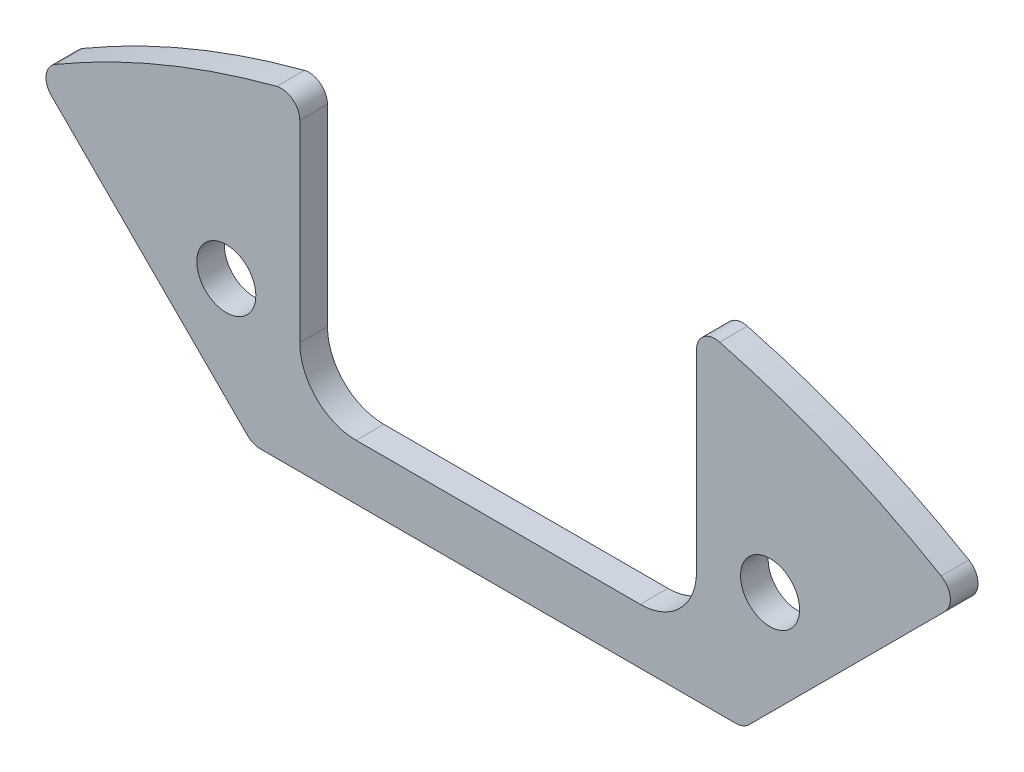
from build123d import *

# Parameters (mm, degrees)
SKETCH_1_R                       = 47.5
EXTRUDE_1_DEPTH                  = 1.5
CUT_EXTRUDE_1_DEPTH              = 68.191889392
CUT_EXTRUDE_2_DEPTH              = 68.191889392
CUT_EXTRUDE_2_DEPTH_BACK         = 68.191889392
SKETCH_3_R                       = 3.1
SKETCH_3_R_2                     = 1.6
SKETCH_4_R                       = 1.6
CUT_EXTRUDE_3_DEPTH              = 68.191889392
CUT_EXTRUDE_4_DEPTH              = 68.191889392
FILLET_1_R                       = 1
FILLET_2_R                       = 0.2
FILLET_3_R                       = 3.05
PATTERN_CIRCULAR_1_COUNT         = 8
FILLET_1_OF_PATTERN_CIRCULAR_1_R = 1
FILLET_2_OF_PATTERN_CIRCULAR_1_R = 0.2
FILLET_3_OF_PATTERN_CIRCULAR_1_R = 3.05
CUT_EXTRUDE_5_DEPTH              = 66.05834985
EXTRUDE_START                    = -1.5
EXTRUDE_2_DEPTH                  = 1.5
FILLET_4_R                       = 1


with BuildPart() as part:
    # ｽｹｯﾁ1 → ﾎﾞｽ - 押し出し1 (new body)
    with BuildSketch(Plane.XY):
        Circle(SKETCH_1_R)
    extrude(amount=EXTRUDE_1_DEPTH)

    # ｽｹｯﾁ2 → ｶｯﾄ - 押し出し1 (cut, through all)
    with BuildSketch(Plane.XY.offset(1.5)):
        Polygon((-10.75, 43.525), (-10.75, 52.5), (10.75, 52.5), (10.75, 43.525), (13, 43.525), (13, 40.475), (10.75, 40.475), (10.75, 31.5), (-10.75, 31.5), (-10.75, 40.475), (-13, 40.475), (-13, 43.525), align=None)
    cut_extrude_1 = extrude(amount=-CUT_EXTRUDE_1_DEPTH, mode=Mode.SUBTRACT)

    # ｽｹｯﾁ3 → ｶｯﾄ - 押し出し2 (cut, two sides: drawn at the far end of the back side and taken through both)
    with BuildSketch(Plane.XY.offset(1.5).offset(-CUT_EXTRUDE_2_DEPTH_BACK)):
        Circle(SKETCH_3_R)
        with Locations((0, 6.5)):
            Circle(SKETCH_3_R_2)
        with Locations((6.5, 0)):
            Circle(SKETCH_3_R_2)
        with Locations((0, -6.5)):
            Circle(SKETCH_3_R_2)
        with Locations((-6.5, 0)):
            Circle(SKETCH_3_R_2)
        with Locations((8.838834765, 8.838834765)):
            Circle(SKETCH_3_R_2)
        with Locations((8.838834765, -8.838834765)):
            Circle(SKETCH_3_R_2)
        with Locations((-8.838834765, -8.838834765)):
            Circle(SKETCH_3_R_2)
        with Locations((-8.838834765, 8.838834765)):
            Circle(SKETCH_3_R_2)
    extrude(amount=CUT_EXTRUDE_2_DEPTH + CUT_EXTRUDE_2_DEPTH_BACK, mode=Mode.SUBTRACT)

    # ｽｹｯﾁ4 → ｶｯﾄ - 押し出し3 (cut, through all)
    with BuildSketch(Plane.XY.offset(1.5)):
        with Locations((14.733312146, 35.569362002)):
            Circle(SKETCH_4_R)
        with Locations((8.610377228, 20.787289482)):
            Circle(SKETCH_4_R)
    cut_extrude_3 = extrude(amount=-CUT_EXTRUDE_3_DEPTH, mode=Mode.SUBTRACT)

    # ｽｹｯﾁ5 → ｶｯﾄ - 押し出し4 (cut, symmetric)
    with BuildSketch(Plane.XY.offset(1.5)):
        Polygon((-7.188286702, 26.5), (7.188286702, 26.5), (3.328075632, 17.180626082), (-3.328075632, 17.180626082), align=None)
    cut_extrude_4 = extrude(amount=CUT_EXTRUDE_4_DEPTH, both=True, mode=Mode.SUBTRACT)

    # ﾌｨﾚｯﾄ1
    fillet_1_edges = [part.edges().sort_by_distance(p)[0] for p in [
        (-3.328075632, 17.180626082, 0.75),
        (3.328075632, 17.180626082, 0.75),
        (7.188286702, 26.5, 0.75),
        (-7.188286702, 26.5, 0.75),
        (10.75, 46.267564232, 0.75),
        (-10.75, 46.267564232, 0.75),
    ]]
    fillet(fillet_1_edges, radius=FILLET_1_R)

    # ﾌｨﾚｯﾄ2
    fillet_2_edges = [part.edges().sort_by_distance(p)[0] for p in [
        (13, 43.525, 0.75),
        (13, 40.475, 0.75),
        (-13, 43.525, 0.75),
        (-13, 40.475, 0.75),
    ]]
    fillet(fillet_2_edges, radius=FILLET_2_R)

    # ﾌｨﾚｯﾄ3
    fillet_3_edges = [part.edges().sort_by_distance(p)[0] for p in [
        (10.75, 31.5, 0.75),
        (-10.75, 31.5, 0.75),
    ]]
    fillet(fillet_3_edges, radius=FILLET_3_R)

    # 円形ﾊﾟﾀｰﾝ1: ｶｯﾄ - 押し出し1, ｶｯﾄ - 押し出し3, ｶｯﾄ - 押し出し4 ×8 about axis
    pattern_circular_1_axis = Axis((0, 0, 0), (0, 0, 1))
    add([cut_extrude_1.rotate(pattern_circular_1_axis, i * 360 / PATTERN_CIRCULAR_1_COUNT) for i in range(1, PATTERN_CIRCULAR_1_COUNT)], mode=Mode.SUBTRACT)
    add([cut_extrude_3.rotate(pattern_circular_1_axis, i * 360 / PATTERN_CIRCULAR_1_COUNT) for i in range(1, PATTERN_CIRCULAR_1_COUNT)], mode=Mode.SUBTRACT)
    add([cut_extrude_4.rotate(pattern_circular_1_axis, i * 360 / PATTERN_CIRCULAR_1_COUNT) for i in range(1, PATTERN_CIRCULAR_1_COUNT)], mode=Mode.SUBTRACT)

    # ﾌｨﾚｯﾄ1 of 円形ﾊﾟﾀｰﾝ1
    fillet_1_of_pattern_circular_1_edges = [part.edges().sort_by_distance(p)[0] for p in [
        (-14.501842056, 9.79523236, 0.75),
        (-9.79523236, 14.501842056, 0.75),
        (-13.655443429, 23.821215973, 0.75),
        (-23.821215973, 13.655443429, 0.75),
        (-25.11471052, 40.317506315, 0.75),
        (-40.317506315, 25.11471052, 0.75),
        (-17.180626082, -3.328075632, 0.75),
        (-17.180626082, 3.328075632, 0.75),
        (-26.5, 7.188286702, 0.75),
        (-26.5, -7.188286702, 0.75),
        (-46.267564232, 10.75, 0.75),
        (-46.267564232, -10.75, 0.75),
        (-9.79523236, -14.501842056, 0.75),
        (-14.501842056, -9.79523236, 0.75),
        (-23.821215973, -13.655443429, 0.75),
        (-13.655443429, -23.821215973, 0.75),
        (-40.317506315, -25.11471052, 0.75),
        (-25.11471052, -40.317506315, 0.75),
        (3.328075632, -17.180626082, 0.75),
        (-3.328075632, -17.180626082, 0.75),
        (-7.188286702, -26.5, 0.75),
        (7.188286702, -26.5, 0.75),
        (-10.75, -46.267564232, 0.75),
        (10.75, -46.267564232, 0.75),
        (14.501842056, -9.79523236, 0.75),
        (9.79523236, -14.501842056, 0.75),
        (13.655443429, -23.821215973, 0.75),
        (23.821215973, -13.655443429, 0.75),
        (25.11471052, -40.317506315, 0.75),
        (40.317506315, -25.11471052, 0.75),
        (17.180626082, 3.328075632, 0.75),
        (17.180626082, -3.328075632, 0.75),
        (26.5, -7.188286702, 0.75),
        (26.5, 7.188286702, 0.75),
        (46.267564232, -10.75, 0.75),
        (46.267564232, 10.75, 0.75),
        (9.79523236, 14.501842056, 0.75),
        (14.501842056, 9.79523236, 0.75),
        (23.821215973, 13.655443429, 0.75),
        (13.655443429, 23.821215973, 0.75),
        (40.317506315, 25.11471052, 0.75),
        (25.11471052, 40.317506315, 0.75),
    ]]
    fillet(fillet_1_of_pattern_circular_1_edges, radius=FILLET_1_OF_PATTERN_CIRCULAR_1_R)

    # ﾌｨﾚｯﾄ2 of 円形ﾊﾟﾀｰﾝ1
    fillet_2_of_pattern_circular_1_edges = [part.edges().sort_by_distance(p)[0] for p in [
        (-21.584434496, 39.969210807, 0.75),
        (-19.427758813, 37.812535124, 0.75),
        (-39.969210807, 21.584434496, 0.75),
        (-37.812535124, 19.427758813, 0.75),
        (-43.525, 13, 0.75),
        (-40.475, 13, 0.75),
        (-43.525, -13, 0.75),
        (-40.475, -13, 0.75),
        (-39.969210807, -21.584434496, 0.75),
        (-37.812535124, -19.427758813, 0.75),
        (-21.584434496, -39.969210807, 0.75),
        (-19.427758813, -37.812535124, 0.75),
        (-13, -43.525, 0.75),
        (-13, -40.475, 0.75),
        (13, -43.525, 0.75),
        (13, -40.475, 0.75),
        (21.584434496, -39.969210807, 0.75),
        (19.427758813, -37.812535124, 0.75),
        (39.969210807, -21.584434496, 0.75),
        (37.812535124, -19.427758813, 0.75),
        (43.525, -13, 0.75),
        (40.475, -13, 0.75),
        (43.525, 13, 0.75),
        (40.475, 13, 0.75),
        (39.969210807, 21.584434496, 0.75),
        (37.812535124, 19.427758813, 0.75),
        (21.584434496, 39.969210807, 0.75),
        (19.427758813, 37.812535124, 0.75),
    ]]
    fillet(fillet_2_of_pattern_circular_1_edges, radius=FILLET_2_OF_PATTERN_CIRCULAR_1_R)

    # ﾌｨﾚｯﾄ3 of 円形ﾊﾟﾀｰﾝ1
    fillet_3_of_pattern_circular_1_edges = [part.edges().sort_by_distance(p)[0] for p in [
        (-14.67246571, 29.875261505, 0.75),
        (-29.875261505, 14.67246571, 0.75),
        (-31.5, 10.75, 0.75),
        (-31.5, -10.75, 0.75),
        (-29.875261505, -14.67246571, 0.75),
        (-14.67246571, -29.875261505, 0.75),
        (-10.75, -31.5, 0.75),
        (10.75, -31.5, 0.75),
        (14.67246571, -29.875261505, 0.75),
        (29.875261505, -14.67246571, 0.75),
        (31.5, -10.75, 0.75),
        (31.5, 10.75, 0.75),
        (29.875261505, 14.67246571, 0.75),
        (14.67246571, 29.875261505, 0.75),
    ]]
    fillet(fillet_3_of_pattern_circular_1_edges, radius=FILLET_3_OF_PATTERN_CIRCULAR_1_R)

    # ｽｹｯﾁ6 → ｶｯﾄ - 押し出し5 (cut, through all)
    with BuildSketch(Plane.XY.offset(1.5)):
        with BuildLine():
            Line((13.297204204, 28.5), (7.7, 28.5))
            Line((7.7, 28.5), (-7.7, 28.5))
            Line((-7.7, 28.5), (-13.297204204, 28.5))
            Line((-13.297204204, 28.5), (-16.829141392, 32.031937188))
            ThreePointArc((-16.829141392, 32.031937188), (-15.935817075, 29.875261505), (-16.829141392, 27.718585823))
            Line((-16.829141392, 27.718585823), (-27.718585823, 16.829141392))
            ThreePointArc((-27.718585823, 16.829141392), (-29.875261505, 15.935817075), (-32.031937188, 16.829141392))
            Line((-32.031937188, 16.829141392), (-36.221544866, 21.018749071))
            Line((-36.221544866, 21.018749071), (-37.671113768, 19.569180169))
            ThreePointArc((-37.671113768, 19.569180169), (-37.812535124, 19.510601526), (-37.95395648, 19.569180169))
            Line((-37.95395648, 19.569180169), (-39.82778945, 21.443013139))
            ThreePointArc((-39.82778945, 21.443013139), (-39.886368094, 21.584434496), (-39.82778945, 21.725855852))
            Line((-39.82778945, 21.725855852), (-38.378220549, 23.175424753))
            Line((-38.378220549, 23.175424753), (-39.414818808, 24.212023012))
            ThreePointArc((-39.414818808, 24.212023012), (-40.249307357, 24.496769993), (-40.984762698, 24.010398301))
            ThreePointArc((-40.984762698, 24.010398301), (-43.884277794, 18.177463037), (-45.958519087, 12.002688172))
            ThreePointArc((-45.958519087, 12.002688172), (-45.78239035, 11.138725991), (-44.990971316, 10.75))
            Line((-44.990971316, 10.75), (-43.525, 10.75))
            Line((-43.525, 10.75), (-43.525, 12.8))
            ThreePointArc((-43.525, 12.8), (-43.466421356, 12.941421356), (-43.325, 13))
            Line((-43.325, 13), (-40.675, 13))
            ThreePointArc((-40.675, 13), (-40.533578644, 12.941421356), (-40.475, 12.8))
            Line((-40.475, 12.8), (-40.475, 10.75))
            Line((-40.475, 10.75), (-34.55, 10.75))
            ThreePointArc((-34.55, 10.75), (-32.393324317, 9.856675683), (-31.5, 7.7))
            Line((-31.5, 7.7), (-31.5, -7.7))
            ThreePointArc((-31.5, -7.7), (-32.393324317, -9.856675683), (-34.55, -10.75))
            Line((-34.55, -10.75), (-40.475, -10.75))
            Line((-40.475, -10.75), (-40.475, -12.8))
            ThreePointArc((-40.475, -12.8), (-40.533578644, -12.941421356), (-40.675, -13))
            Line((-40.675, -13), (-43.325, -13))
            ThreePointArc((-43.325, -13), (-43.466421356, -12.941421356), (-43.525, -12.8))
            Line((-43.525, -12.8), (-43.525, -10.75))
            Line((-43.525, -10.75), (-44.990971316, -10.75))
            ThreePointArc((-44.990971316, -10.75), (-45.78239035, -11.138725991), (-45.958519087, -12.002688172))
            ThreePointArc((-45.958519087, -12.002688172), (-43.884277794, -18.177463037), (-40.984762698, -24.010398301))
            ThreePointArc((-40.984762698, -24.010398301), (-40.249307357, -24.496769993), (-39.414818808, -24.212023012))
            Line((-39.414818808, -24.212023012), (-38.378220549, -23.175424753))
            Line((-38.378220549, -23.175424753), (-39.82778945, -21.725855852))
            ThreePointArc((-39.82778945, -21.725855852), (-39.886368094, -21.584434496), (-39.82778945, -21.443013139))
            Line((-39.82778945, -21.443013139), (-37.95395648, -19.569180169))
            ThreePointArc((-37.95395648, -19.569180169), (-37.812535124, -19.510601526), (-37.671113768, -19.569180169))
            Line((-37.671113768, -19.569180169), (-36.221544866, -21.018749071))
            Line((-36.221544866, -21.018749071), (-32.031937188, -16.829141392))
            ThreePointArc((-32.031937188, -16.829141392), (-29.875261505, -15.935817075), (-27.718585823, -16.829141392))
            Line((-27.718585823, -16.829141392), (-16.829141392, -27.718585823))
            ThreePointArc((-16.829141392, -27.718585823), (-15.935817075, -29.875261505), (-16.829141392, -32.031937188))
            Line((-16.829141392, -32.031937188), (-21.018749071, -36.221544866))
            Line((-21.018749071, -36.221544866), (-19.569180169, -37.671113768))
            ThreePointArc((-19.569180169, -37.671113768), (-19.510601526, -37.812535124), (-19.569180169, -37.95395648))
            Line((-19.569180169, -37.95395648), (-21.443013139, -39.82778945))
            ThreePointArc((-21.443013139, -39.82778945), (-21.584434496, -39.886368094), (-21.725855852, -39.82778945))
            Line((-21.725855852, -39.82778945), (-23.175424753, -38.378220549))
            Line((-23.175424753, -38.378220549), (-24.212023012, -39.414818808))
            ThreePointArc((-24.212023012, -39.414818808), (-24.496769993, -40.249307357), (-24.010398301, -40.984762698))
            ThreePointArc((-24.010398301, -40.984762698), (-18.177463037, -43.884277794), (-12.002688172, -45.958519087))
            ThreePointArc((-12.002688172, -45.958519087), (-11.138725991, -45.78239035), (-10.75, -44.990971316))
            Line((-10.75, -44.990971316), (-10.75, -43.525))
            Line((-10.75, -43.525), (-12.8, -43.525))
            ThreePointArc((-12.8, -43.525), (-12.941421356, -43.466421356), (-13, -43.325))
            Line((-13, -43.325), (-13, -40.675))
            ThreePointArc((-13, -40.675), (-12.941421356, -40.533578644), (-12.8, -40.475))
            Line((-12.8, -40.475), (-10.75, -40.475))
            Line((-10.75, -40.475), (-10.75, -34.55))
            ThreePointArc((-10.75, -34.55), (-9.856675683, -32.393324317), (-7.7, -31.5))
            Line((-7.7, -31.5), (7.7, -31.5))
            ThreePointArc((7.7, -31.5), (9.856675683, -32.393324317), (10.75, -34.55))
            Line((10.75, -34.55), (10.75, -40.475))
            Line((10.75, -40.475), (12.8, -40.475))
            ThreePointArc((12.8, -40.475), (12.941421356, -40.533578644), (13, -40.675))
            Line((13, -40.675), (13, -43.325))
            ThreePointArc((13, -43.325), (12.941421356, -43.466421356), (12.8, -43.525))
            Line((12.8, -43.525), (10.75, -43.525))
            Line((10.75, -43.525), (10.75, -44.990971316))
            ThreePointArc((10.75, -44.990971316), (11.138725991, -45.78239035), (12.002688172, -45.958519087))
            ThreePointArc((12.002688172, -45.958519087), (18.177463037, -43.884277794), (24.010398301, -40.984762698))
            ThreePointArc((24.010398301, -40.984762698), (24.496769993, -40.249307357), (24.212023012, -39.414818808))
            Line((24.212023012, -39.414818808), (23.175424753, -38.378220549))
            Line((23.175424753, -38.378220549), (21.725855852, -39.82778945))
            ThreePointArc((21.725855852, -39.82778945), (21.584434496, -39.886368094), (21.443013139, -39.82778945))
            Line((21.443013139, -39.82778945), (19.569180169, -37.95395648))
            ThreePointArc((19.569180169, -37.95395648), (19.510601526, -37.812535124), (19.569180169, -37.671113768))
            Line((19.569180169, -37.671113768), (21.018749071, -36.221544866))
            Line((21.018749071, -36.221544866), (16.829141392, -32.031937188))
            ThreePointArc((16.829141392, -32.031937188), (15.935817075, -29.875261505), (16.829141392, -27.718585823))
            Line((16.829141392, -27.718585823), (27.718585823, -16.829141392))
            ThreePointArc((27.718585823, -16.829141392), (29.875261505, -15.935817075), (32.031937188, -16.829141392))
            Line((32.031937188, -16.829141392), (36.221544866, -21.018749071))
            Line((36.221544866, -21.018749071), (37.671113768, -19.569180169))
            ThreePointArc((37.671113768, -19.569180169), (37.812535124, -19.510601526), (37.95395648, -19.569180169))
            Line((37.95395648, -19.569180169), (39.82778945, -21.443013139))
            ThreePointArc((39.82778945, -21.443013139), (39.886368094, -21.584434496), (39.82778945, -21.725855852))
            Line((39.82778945, -21.725855852), (38.378220549, -23.175424753))
            Line((38.378220549, -23.175424753), (39.414818808, -24.212023012))
            ThreePointArc((39.414818808, -24.212023012), (40.249307357, -24.496769993), (40.984762698, -24.010398301))
            ThreePointArc((40.984762698, -24.010398301), (43.884277794, -18.177463037), (45.958519087, -12.002688172))
            ThreePointArc((45.958519087, -12.002688172), (45.78239035, -11.138725991), (44.990971316, -10.75))
            Line((44.990971316, -10.75), (43.525, -10.75))
            Line((43.525, -10.75), (43.525, -12.8))
            ThreePointArc((43.525, -12.8), (43.466421356, -12.941421356), (43.325, -13))
            Line((43.325, -13), (40.675, -13))
            ThreePointArc((40.675, -13), (40.533578644, -12.941421356), (40.475, -12.8))
            Line((40.475, -12.8), (40.475, -10.75))
            Line((40.475, -10.75), (34.55, -10.75))
            ThreePointArc((34.55, -10.75), (32.393324317, -9.856675683), (31.5, -7.7))
            Line((31.5, -7.7), (31.5, 7.7))
            ThreePointArc((31.5, 7.7), (32.393324317, 9.856675683), (34.55, 10.75))
            Line((34.55, 10.75), (40.475, 10.75))
            Line((40.475, 10.75), (40.475, 12.8))
            ThreePointArc((40.475, 12.8), (40.533578644, 12.941421356), (40.675, 13))
            Line((40.675, 13), (43.325, 13))
            ThreePointArc((43.325, 13), (43.466421356, 12.941421356), (43.525, 12.8))
            Line((43.525, 12.8), (43.525, 10.75))
            Line((43.525, 10.75), (44.990971316, 10.75))
            ThreePointArc((44.990971316, 10.75), (45.78239035, 11.138725991), (45.958519087, 12.002688172))
            ThreePointArc((45.958519087, 12.002688172), (43.884277794, 18.177463037), (40.984762698, 24.010398301))
            ThreePointArc((40.984762698, 24.010398301), (40.249307357, 24.496769993), (39.414818808, 24.212023012))
            Line((39.414818808, 24.212023012), (38.378220549, 23.175424753))
            Line((38.378220549, 23.175424753), (39.82778945, 21.725855852))
            ThreePointArc((39.82778945, 21.725855852), (39.886368094, 21.584434496), (39.82778945, 21.443013139))
            Line((39.82778945, 21.443013139), (37.95395648, 19.569180169))
            ThreePointArc((37.95395648, 19.569180169), (37.812535124, 19.510601526), (37.671113768, 19.569180169))
            Line((37.671113768, 19.569180169), (36.221544866, 21.018749071))
            Line((36.221544866, 21.018749071), (32.031937188, 16.829141392))
            ThreePointArc((32.031937188, 16.829141392), (29.875261505, 15.935817075), (27.718585823, 16.829141392))
            Line((27.718585823, 16.829141392), (16.829141392, 27.718585823))
            ThreePointArc((16.829141392, 27.718585823), (15.935817075, 29.875261505), (16.829141392, 32.031937188))
            Line((16.829141392, 32.031937188), (13.297204204, 28.5))
        make_face()
    extrude(amount=-CUT_EXTRUDE_5_DEPTH, mode=Mode.SUBTRACT)

    # ｽｹｯﾁ7 → ﾎﾞｽ - 押し出し2 (add)
    with BuildSketch(Plane.XY.offset(1.5).offset(EXTRUDE_START)):
        with BuildLine():
            Line((-10.75, 40.475), (-10.75, 43.525))
            Line((-10.75, 43.525), (-12.8, 43.525))
            ThreePointArc((-12.8, 43.525), (-12.941421356, 43.466421356), (-13, 43.325))
            Line((-13, 43.325), (-13, 40.675))
            ThreePointArc((-13, 40.675), (-12.941421356, 40.533578644), (-12.8, 40.475))
            Line((-12.8, 40.475), (-10.75, 40.475))
        make_face()
        with BuildLine():
            Line((-21.725855852, 39.82778945), (-23.175424753, 38.378220549))
            Line((-23.175424753, 38.378220549), (-21.018749071, 36.221544866))
            Line((-21.018749071, 36.221544866), (-19.569180169, 37.671113768))
            ThreePointArc((-19.569180169, 37.671113768), (-19.510601526, 37.812535124), (-19.569180169, 37.95395648))
            Line((-19.569180169, 37.95395648), (-21.443013139, 39.82778945))
            ThreePointArc((-21.443013139, 39.82778945), (-21.584434496, 39.886368094), (-21.725855852, 39.82778945))
        make_face()
        with BuildLine():
            Line((10.75, 43.525), (10.75, 40.475))
            Line((10.75, 40.475), (12.8, 40.475))
            ThreePointArc((12.8, 40.475), (12.941421356, 40.533578644), (13, 40.675))
            Line((13, 40.675), (13, 43.325))
            ThreePointArc((13, 43.325), (12.941421356, 43.466421356), (12.8, 43.525))
            Line((12.8, 43.525), (10.75, 43.525))
        make_face()
        with BuildLine():
            Line((19.569180169, 37.671113768), (21.018749071, 36.221544866))
            Line((21.018749071, 36.221544866), (23.175424753, 38.378220549))
            Line((23.175424753, 38.378220549), (21.725855852, 39.82778945))
            ThreePointArc((21.725855852, 39.82778945), (21.584434496, 39.886368094), (21.443013139, 39.82778945))
            Line((21.443013139, 39.82778945), (19.569180169, 37.95395648))
            ThreePointArc((19.569180169, 37.95395648), (19.510601526, 37.812535124), (19.569180169, 37.671113768))
        make_face()
    extrude(amount=EXTRUDE_2_DEPTH)

    # ﾌｨﾚｯﾄ4
    fillet_4_edges = [part.edges().sort_by_distance(p)[0] for p in [
        (13.297204204, 28.5, 0.75),
        (-13.297204204, 28.5, 0.75),
    ]]
    fillet(fillet_4_edges, radius=FILLET_4_R)


solid = part.part
